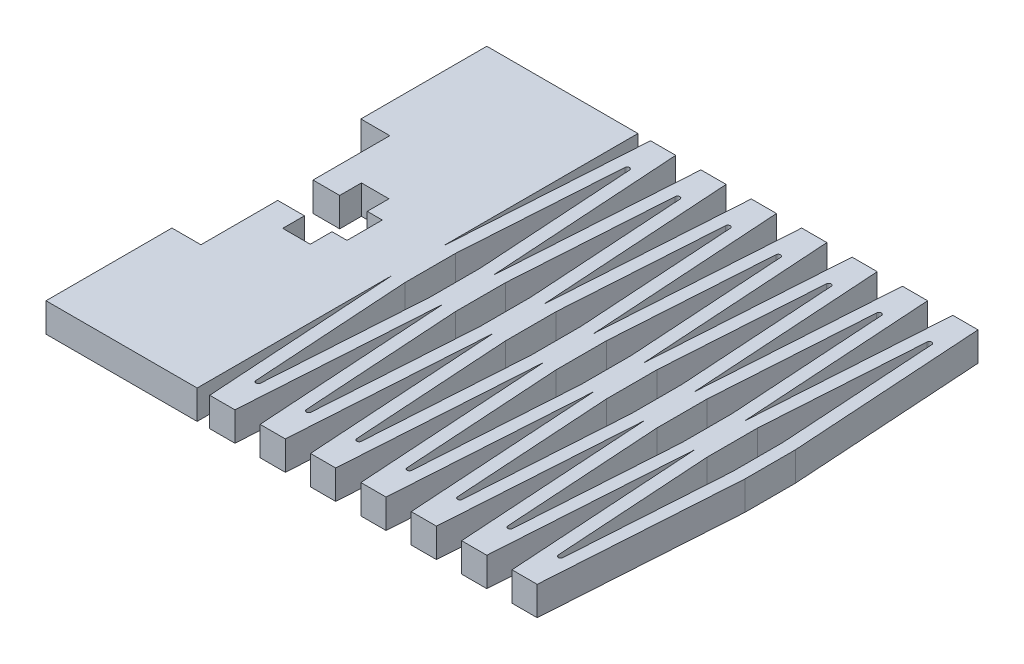
from build123d import *

# Parameters (mm, degrees)
BOSS_EXTRUDE1_DEPTH = 2.921


with BuildPart() as part:
    # Sketch2 → Boss-Extrude1 (new body)
    with BuildSketch(Plane(origin=(0, 0, 0), x_dir=(1, 0, 0), z_dir=(0, 1, 0))):
        Polygon((0, 12.7), (2.921, 12.7), (2.921, 20.447), (5.612336386, 20.447), (5.612336386, 18.25625), (8.390461386, 18.25625), (8.390461386, 20.447), (9.906, 20.447), (9.906, 24.003), (8.390461386, 24.003), (8.390461386, 26.19375), (5.612336386, 26.19375), (5.612336386, 24.003), (2.921, 24.003), (2.921, 31.75), (0, 31.75), (0, 44.45), (15.24, 44.45), (15.24, 24.765), (16.51, 44.45), (19.05, 44.45), (20.32, 24.765), (21.59, 44.45), (24.13, 44.45), (25.4, 24.765), (26.67, 44.45), (29.21, 44.45), (30.48, 24.765), (31.75, 44.45), (34.29, 44.45), (35.56, 24.765), (36.83, 44.45), (39.37, 44.45), (40.64, 24.765), (41.91, 44.45), (44.45, 44.45), (45.72, 24.765), (46.99, 44.45), (49.53, 44.45), (50.8, 24.765), (50.8, 19.685), (49.53, 0), (46.99, 0), (45.72, 19.685), (44.45, 0), (41.91, 0), (40.64, 19.685), (39.37, 0), (36.83, 0), (35.56, 19.685), (34.29, 0), (31.75, 0), (30.48, 19.685), (29.21, 0), (26.67, 0), (25.4, 19.685), (24.13, 0), (21.59, 0), (20.32, 19.685), (19.05, 0), (16.51, 0), (15.24, 19.685), (15.24, 0), (0, 0), align=None)
        with BuildLine():
            Line((48.025626044, 40.817203674), (46.99, 24.765))
            Line((46.99, 24.765), (46.99, 19.685))
            Line((46.99, 19.685), (48.025626044, 3.632796326))
            ThreePointArc((48.025626044, 3.632796326), (48.26, 3.398422369), (48.494373956, 3.632796326))
            Line((48.494373956, 3.632796326), (49.53, 19.685))
            Line((49.53, 19.685), (49.53, 24.765))
            Line((49.53, 24.765), (48.494373956, 40.817203674))
            ThreePointArc((48.494373956, 40.817203674), (48.26, 41.051577631), (48.025626044, 40.817203674))
        make_face(mode=Mode.SUBTRACT)
        with BuildLine():
            Line((42.945626044, 40.817203674), (41.91, 24.765))
            Line((41.91, 24.765), (41.91, 19.685))
            Line((41.91, 19.685), (42.945626044, 3.632796326))
            ThreePointArc((42.945626044, 3.632796326), (43.18, 3.398422369), (43.414373956, 3.632796326))
            Line((43.414373956, 3.632796326), (44.45, 19.685))
            Line((44.45, 19.685), (44.45, 24.765))
            Line((44.45, 24.765), (43.414373956, 40.817203674))
            ThreePointArc((43.414373956, 40.817203674), (43.18, 41.051577631), (42.945626044, 40.817203674))
        make_face(mode=Mode.SUBTRACT)
        with BuildLine():
            Line((37.865626044, 40.817203674), (36.83, 24.765))
            Line((36.83, 24.765), (36.83, 19.685))
            Line((36.83, 19.685), (37.865626044, 3.632796326))
            ThreePointArc((37.865626044, 3.632796326), (38.1, 3.398422369), (38.334373956, 3.632796326))
            Line((38.334373956, 3.632796326), (39.37, 19.685))
            Line((39.37, 19.685), (39.37, 24.765))
            Line((39.37, 24.765), (38.334373956, 40.817203674))
            ThreePointArc((38.334373956, 40.817203674), (38.1, 41.051577631), (37.865626044, 40.817203674))
        make_face(mode=Mode.SUBTRACT)
        with BuildLine():
            Line((32.785626044, 40.817203674), (31.75, 24.765))
            Line((31.75, 24.765), (31.75, 19.685))
            Line((31.75, 19.685), (32.785626044, 3.632796326))
            ThreePointArc((32.785626044, 3.632796326), (33.02, 3.398422369), (33.254373956, 3.632796326))
            Line((33.254373956, 3.632796326), (34.29, 19.685))
            Line((34.29, 19.685), (34.29, 24.765))
            Line((34.29, 24.765), (33.254373956, 40.817203674))
            ThreePointArc((33.254373956, 40.817203674), (33.02, 41.051577631), (32.785626044, 40.817203674))
        make_face(mode=Mode.SUBTRACT)
        with BuildLine():
            Line((27.705626044, 40.817203674), (26.67, 24.765))
            Line((26.67, 24.765), (26.67, 19.685))
            Line((26.67, 19.685), (27.705626044, 3.632796326))
            ThreePointArc((27.705626044, 3.632796326), (27.94, 3.398422369), (28.174373956, 3.632796326))
            Line((28.174373956, 3.632796326), (29.21, 19.685))
            Line((29.21, 19.685), (29.21, 24.765))
            Line((29.21, 24.765), (28.174373956, 40.817203674))
            ThreePointArc((28.174373956, 40.817203674), (27.94, 41.051577631), (27.705626044, 40.817203674))
        make_face(mode=Mode.SUBTRACT)
        with BuildLine():
            Line((22.625626044, 40.817203674), (21.59, 24.765))
            Line((21.59, 24.765), (21.59, 19.685))
            Line((21.59, 19.685), (22.625626044, 3.632796326))
            ThreePointArc((22.625626044, 3.632796326), (22.86, 3.398422369), (23.094373956, 3.632796326))
            Line((23.094373956, 3.632796326), (24.13, 19.685))
            Line((24.13, 19.685), (24.13, 24.765))
            Line((24.13, 24.765), (23.094373956, 40.817203674))
            ThreePointArc((23.094373956, 40.817203674), (22.86, 41.051577631), (22.625626044, 40.817203674))
        make_face(mode=Mode.SUBTRACT)
        with BuildLine():
            Line((17.545626044, 40.817203674), (16.51, 24.765))
            Line((16.51, 24.765), (16.51, 19.685))
            Line((16.51, 19.685), (17.545626044, 3.632796326))
            ThreePointArc((17.545626044, 3.632796326), (17.78, 3.398422369), (18.014373956, 3.632796326))
            Line((18.014373956, 3.632796326), (19.05, 19.685))
            Line((19.05, 19.685), (19.05, 24.765))
            Line((19.05, 24.765), (18.014373956, 40.817203674))
            ThreePointArc((18.014373956, 40.817203674), (17.78, 41.051577631), (17.545626044, 40.817203674))
        make_face(mode=Mode.SUBTRACT)
    extrude(amount=BOSS_EXTRUDE1_DEPTH)


solid = part.part
